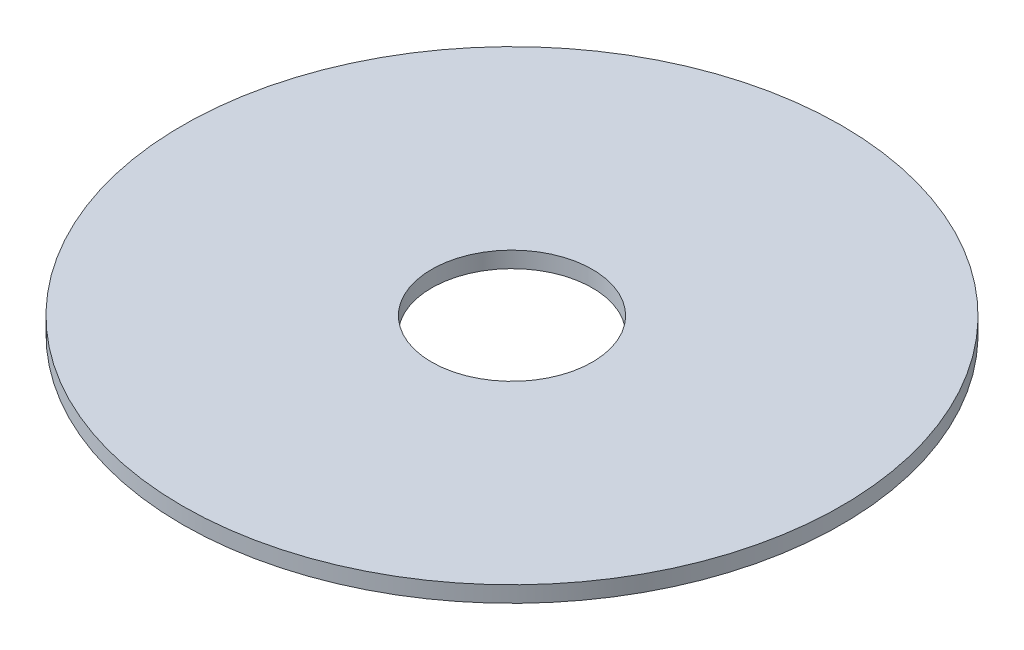
from build123d import *

# Parameters (mm, degrees)
SKETCH1_R           = 41
SKETCH1_R_2         = 10
BOSS_EXTRUDE1_DEPTH = 2


with BuildPart() as part:
    # Sketch1 → Boss-Extrude1 (new body)
    with BuildSketch(Plane(origin=(0, 0, 0), x_dir=(1, 0, 0), z_dir=(0, 1, 0))):
        with Locations(Location((0, 0, 0), (0, 0, 270))):
            Circle(SKETCH1_R)
        with Locations(Location((0, 0, 0), (0, 0, 270))):
            Circle(SKETCH1_R_2, mode=Mode.SUBTRACT)
    extrude(amount=BOSS_EXTRUDE1_DEPTH)


solid = part.part
